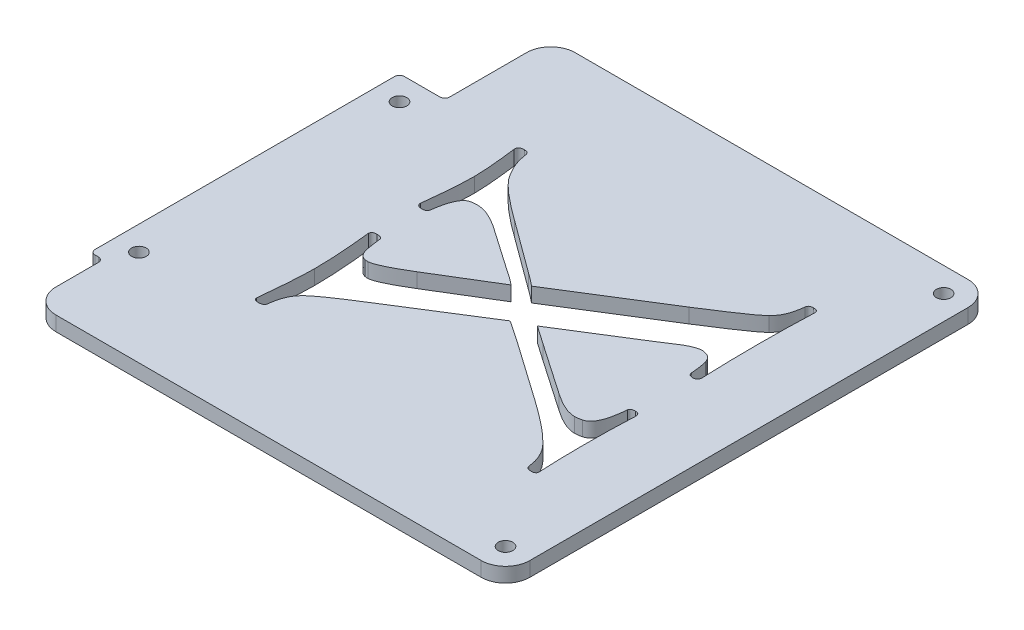
from build123d import *

# Parameters (mm, degrees)
BOSS_EXTRUDE1_DEPTH = 3
FILLET3_R           = 5
FILLET2_R           = 1
SKETCH2_R           = 1.5
CUT_EXTRUDE1_DEPTH  = 3
CUT_EXTRUDE2_DEPTH  = 3


with BuildPart() as part:
    # Sketch1 → Boss-Extrude1 (new body)
    with BuildSketch(Plane(origin=(0, 23, 0), x_dir=(1, 0, 0), z_dir=(0, 1, 0))):
        Polygon((98.305417602, 50), (98.305417602, 28.219474586), (89, 28.219474586), (89, -35.308001182), (91.659783805, -35.308001182), (91.659783805, -50), (97.650210801, -50), (189, -50), (189, 50), align=None)
    extrude(amount=BOSS_EXTRUDE1_DEPTH)

    # Fillet3
    fillet3_edges = [part.edges().sort_by_distance(p)[0] for p in [
        (189, 24.5, 50),
        (91.659783805, 24.5, 50),
        (98.305417602, 24.5, -50),
        (189, 24.5, -50),
    ]]
    fillet(fillet3_edges, radius=FILLET3_R)

    # Fillet2
    fillet2_edges = [part.edges().sort_by_distance(p)[0] for p in [
        (91.659783805, 24.5, 35.308001182),
        (89, 24.5, 35.308001182),
        (89, 24.5, -28.219474586),
        (98.305417602, 24.5, -28.219474586),
    ]]
    fillet(fillet2_edges, radius=FILLET2_R)

    # Sketch2 → Cut-Extrude1 (cut)
    with BuildSketch(Plane(origin=(0, 23, 0), x_dir=(1, 0, 0), z_dir=(0, 1, 0))):
        with Locations(Location((184, -45, 0), (0, 0, 90))):
            Circle(SKETCH2_R)
        with Locations(Location((94, -30.308001182, 0), (0, 0, 90))):
            Circle(SKETCH2_R)
        with Locations(Location((94, 23.219474586, 0), (0, 0, 90))):
            Circle(SKETCH2_R)
        with Locations(Location((184, 45, 0), (0, 0, 90))):
            Circle(SKETCH2_R)
    extrude(amount=CUT_EXTRUDE1_DEPTH, mode=Mode.SUBTRACT)

    # Sketch4 → Cut-Extrude2 (cut)
    with BuildSketch(Plane(origin=(0, 23, 0), x_dir=(1, 0, 0), z_dir=(0, 1, 0))):
        with BuildLine():
            Line((144.351606199, -4.405002967), (127.464586968, -15.042022198))
            add(Edge.make_bspline(
                [(127.464586968, -15.042022198), (126.898195291, -15.392246735), (125.816649312, -16.061013517), (124.298008902, -17.050886016), (122.928570135, -17.937550274), (121.736460133, -18.755591493), (120.693040345, -19.471486976), (119.829981473, -20.120669627), (119.12574917, -20.683215798), (118.725159512, -21.045947399), (118.546317738, -21.207887583)],
                knots=[0, 0, 0, 0, 1.472320828, 2.811451392, 4.007980441, 5.079214572, 6.008113963, 6.805362668, 7.466658574, 8, 8, 8, 8], degree=3))
            add(Edge.make_bspline(
                [(118.546317738, -21.207887583), (118.263268852, -21.52191014), (117.683869123, -22.164712831), (117.069628337, -23.367577881), (116.612007961, -24.745013365), (116.485430713, -25.743352665), (116.418913892, -26.267983736)],
                knots=[0, 0, 0, 0, 0.902760983, 1.847947461, 2.869088265, 4, 4, 4, 4], degree=3))
            add(Edge.make_bspline(
                [(116.418913892, -26.267983736), (116.387940503, -26.380485447), (116.328812035, -26.595252187), (116.080845919, -26.857180094), (115.710546665, -26.9748707), (115.437845471, -26.991879637), (115.289106199, -27.001156813)],
                knots=[0, 0, 0, 0, 0.934842855, 1.784623105, 2.791668119, 4, 4, 4, 4], degree=3))
            add(Edge.make_bspline(
                [(115.289106199, -27.001156813), (115.130908357, -26.999292557), (114.851041741, -26.995994514), (114.501215815, -26.864071662), (114.242986627, -26.653061509), (114.219472959, -26.454352171), (114.20737543, -26.352118352)],
                knots=[0, 0, 0, 0, 1.334053444, 2.360063937, 3.15627052, 4, 4, 4, 4], degree=3))
            add(Edge.make_bspline(
                [(114.20737543, -26.352118352), (114.268178243, -25.731192556), (114.385045957, -24.537725092), (114.542697081, -22.811043643), (114.674899579, -21.216431706), (114.783146686, -19.754038379), (114.868719382, -18.427912295), (114.929513254, -17.23393227), (114.96811794, -16.172085521), (114.97391698, -15.506792147), (114.976606199, -15.198272198)],
                knots=[0, 0, 0, 0, 1.338835045, 2.573344634, 3.720713761, 4.772456593, 5.720092408, 6.572327828, 7.337938175, 8, 8, 8, 8], degree=3))
            add(Edge.make_bspline(
                [(114.976606199, -15.198272198), (114.966353935, -14.352743878), (114.944718967, -12.568457125), (114.788786135, -9.755087799), (114.550052177, -6.665181967), (114.324888908, -4.516691888), (114.20737543, -3.395387583)],
                knots=[0, 0, 0, 0, 0.857425488, 1.8093929, 2.856714678, 4, 4, 4, 4], degree=3))
            add(Edge.make_bspline(
                [(114.20737543, -3.395387583), (114.219504891, -3.282548355), (114.242815012, -3.065696499), (114.485943912, -2.807073443), (114.858043405, -2.682888604), (115.139907847, -2.669736878), (115.30112543, -2.662214506)],
                knots=[0, 0, 0, 0, 0.896287379, 1.722464648, 2.697321511, 4, 4, 4, 4], degree=3))
            add(Edge.make_bspline(
                [(115.30112543, -2.662214506), (115.454724646, -2.666597614), (115.726836384, -2.674362596), (116.076824294, -2.781865744), (116.347574841, -2.95469515), (116.411314659, -3.136752797), (116.442952353, -3.227118352)],
                knots=[0, 0, 0, 0, 1.332929307, 2.361377367, 3.186658482, 4, 4, 4, 4], degree=3))
            add(Edge.make_bspline(
                [(116.442952353, -3.227118352), (116.497916769, -3.671982018), (116.597069328, -4.474489789), (116.745095088, -5.551059507), (116.903778138, -6.367065066), (117.037474033, -6.817488836), (117.091990815, -7.001156813)],
                knots=[0, 0, 0, 0, 1.402649067, 2.530296048, 3.400703139, 4, 4, 4, 4], degree=3))
            add(Edge.make_bspline(
                [(117.091990815, -7.001156813), (117.163574771, -7.178202401), (117.300694232, -7.517334195), (117.637220309, -7.934591169), (118.043428733, -8.253438433), (118.36170506, -8.363764981), (118.522279276, -8.419426044)],
                knots=[0, 0, 0, 0, 1.087727893, 2.083548742, 3.033127403, 4, 4, 4, 4], degree=3))
            add(Edge.make_bspline(
                [(118.522279276, -8.419426044), (118.630304172, -8.43344845), (118.845766867, -8.461417053), (119.062998086, -8.465478018), (119.171317738, -8.467502967)],
                knots=[0, 0, 0, 0, 1.002724816, 2, 2, 2, 2], degree=3))
            add(Edge.make_bspline(
                [(119.171317738, -8.467502967), (119.316448598, -8.45638107), (119.653109081, -8.430581573), (120.204532816, -8.250909029), (120.88139693, -8.002753917), (121.669593013, -7.626516985), (122.602749101, -7.193065113), (123.639286004, -6.616881611), (124.806837448, -5.958831664), (125.618620375, -5.476455961), (126.046317738, -5.222310659)],
                knots=[0, 0, 0, 0, 0.455388663, 1.056366421, 1.80829184, 2.719763092, 3.793795105, 5.036993135, 6.438905055, 8, 8, 8, 8], degree=3))
            Line((126.046317738, -5.222310659), (138.053529276, 2.085381648))
            add(Edge.make_bspline(
                [(138.053529276, 2.085381648), (137.625539491, 2.428371758), (136.709075245, 3.162824268), (135.727924095, 3.808529268), (135.204971584, 4.152689341)],
                knots=[0, 0, 0, 0, 0.934002144, 2, 2, 2, 2], degree=3))
            Line((135.204971584, 4.152689341), (125.721798507, 10.727208571))
            add(Edge.make_bspline(
                [(125.721798507, 10.727208571), (125.210941024, 11.050460946), (124.260516269, 11.651855797), (122.85079505, 12.333795342), (121.580650763, 12.770656194), (120.768488483, 12.836525319), (120.397279276, 12.866631648)],
                knots=[0, 0, 0, 0, 1.247971206, 2.321787911, 3.232951599, 4, 4, 4, 4], degree=3))
            add(Edge.make_bspline(
                [(120.397279276, 12.866631648), (120.168294528, 12.860419876), (119.687368419, 12.847373578), (119.214638474, 12.75747602), (118.966990815, 12.710381648)],
                knots=[0, 0, 0, 0, 0.952265823, 2, 2, 2, 2], degree=3))
            add(Edge.make_bspline(
                [(118.966990815, 12.710381648), (118.814875446, 12.64937105), (118.495315611, 12.521201642), (118.068424889, 12.167626018), (117.697698582, 11.674411308), (117.376577481, 11.043719136), (117.079856792, 10.286993292), (116.815115154, 9.391108691), (116.605859048, 8.35647488), (116.499220799, 7.618833988), (116.442952353, 7.229612417)],
                knots=[0, 0, 0, 0, 0.620651059, 1.303846888, 2.075212062, 2.954796131, 3.987916046, 5.164650224, 6.50390711, 8, 8, 8, 8], degree=3))
            add(Edge.make_bspline(
                [(116.442952353, 7.229612417), (116.416940226, 7.112745653), (116.367130285, 6.888960539), (116.125303524, 6.629167127), (115.784814478, 6.478578705), (115.527305163, 6.466850862), (115.385260045, 6.460381648)],
                knots=[0, 0, 0, 0, 0.978881351, 1.874434332, 2.82751339, 4, 4, 4, 4], degree=3))
            add(Edge.make_bspline(
                [(115.385260045, 6.460381648), (115.210395971, 6.463299781), (114.901482009, 6.468454939), (114.508332777, 6.645053538), (114.236087746, 6.934658897), (114.217206325, 7.183949923), (114.20737543, 7.313747033)],
                knots=[0, 0, 0, 0, 1.261486588, 2.228535625, 3.07766052, 4, 4, 4, 4], degree=3))
            add(Edge.make_bspline(
                [(114.20737543, 7.313747033), (114.268416816, 7.854508859), (114.386829326, 8.903517889), (114.543843905, 10.433970874), (114.675208596, 11.86842069), (114.784687163, 13.206542418), (114.869564266, 14.444607976), (114.929969489, 15.586548033), (114.968683047, 16.632388141), (114.974051853, 17.297692402), (114.976606199, 17.614227802)],
                knots=[0, 0, 0, 0, 1.263852355, 2.451712507, 3.572946922, 4.609147954, 5.569733427, 6.454894785, 7.264876952, 8, 8, 8, 8], degree=3))
            add(Edge.make_bspline(
                [(114.976606199, 17.614227802), (114.974003298, 17.874678434), (114.968475016, 18.427847421), (114.929540125, 19.305427434), (114.869074048, 20.279095234), (114.784140053, 21.34888522), (114.674500217, 22.518702864), (114.543441584, 23.784925284), (114.385299658, 25.150965033), (114.268196519, 26.091880692), (114.20737543, 26.580573956)],
                knots=[0, 0, 0, 0, 0.69420381, 1.474413845, 2.34104263, 3.294390515, 4.334682741, 5.472713655, 6.687376705, 8, 8, 8, 8], degree=3))
            add(Edge.make_bspline(
                [(114.20737543, 26.580573956), (114.217577606, 26.721020585), (114.237058609, 26.989202725), (114.493672996, 27.322573749), (114.904183999, 27.494156335), (115.211256703, 27.509423045), (115.385260045, 27.518073956)],
                knots=[0, 0, 0, 0, 0.970347507, 1.852873742, 2.783326749, 4, 4, 4, 4], degree=3))
            add(Edge.make_bspline(
                [(115.385260045, 27.518073956), (115.526951308, 27.507387883), (115.790530005, 27.487509301), (116.153040554, 27.316869106), (116.368105009, 26.978814056), (116.409007813, 26.719548958), (116.430933122, 26.580573956)],
                knots=[0, 0, 0, 0, 1.080128821, 2.009290766, 2.932911441, 4, 4, 4, 4], degree=3))
            add(Edge.make_bspline(
                [(116.430933122, 26.580573956), (116.516348907, 26.08799141), (116.691362911, 25.078706715), (117.249960375, 23.58987962), (118.002945616, 22.073780289), (118.669367281, 21.115918163), (119.015067738, 20.619035494)],
                knots=[0, 0, 0, 0, 0.912299322, 1.869269932, 2.894702262, 4, 4, 4, 4], degree=3))
            add(Edge.make_bspline(
                [(119.015067738, 20.619035494), (119.192546105, 20.408141742), (119.572599716, 19.956532155), (120.248788208, 19.284099273), (121.034141778, 18.541873374), (121.959064876, 17.748043668), (123.001703526, 16.882553452), (124.17634726, 15.961198449), (125.481767215, 14.989096948), (126.390522782, 14.32048406), (126.86362543, 13.972400879)],
                knots=[0, 0, 0, 0, 0.641462297, 1.373632554, 2.218314875, 3.157246719, 4.210645128, 5.373201843, 6.632475872, 8, 8, 8, 8], degree=3))
            Line((126.86362543, 13.972400879), (137.656894661, 6.051727802))
            add(Edge.make_bspline(
                [(137.656894661, 6.051727802), (138.088794504, 5.743444252), (139.012780403, 5.083917146), (139.892637272, 4.366496146), (140.361221584, 3.98442011)],
                knots=[0, 0, 0, 0, 0.934862412, 2, 2, 2, 2], degree=3))
            Line((140.361221584, 3.98442011), (160.289106199, 16.436343187))
            add(Edge.make_bspline(
                [(160.289106199, 16.436343187), (160.938640397, 16.852246648), (162.171218805, 17.641479346), (163.912766037, 18.773176707), (165.455139669, 19.775082238), (166.770331705, 20.678996589), (167.881094102, 21.445268828), (168.777850636, 22.094547837), (169.461362995, 22.630622941), (169.841251607, 22.957744074), (170.000644661, 23.094997033)],
                knots=[0, 0, 0, 0, 1.570948896, 2.981086596, 4.230448196, 5.316880004, 6.231423087, 6.978976257, 7.571600499, 8, 8, 8, 8], degree=3))
            add(Edge.make_bspline(
                [(170.000644661, 23.094997033), (170.291905749, 23.429099085), (170.884472926, 24.108825688), (171.518260826, 25.364560381), (171.967816943, 26.798429222), (172.096693244, 27.831209773), (172.164106199, 28.371439341)],
                knots=[0, 0, 0, 0, 0.911944529, 1.855340164, 2.87816569, 4, 4, 4, 4], degree=3))
            add(Edge.make_bspline(
                [(172.164106199, 28.371439341), (172.186816503, 28.479616779), (172.230811323, 28.689180106), (172.462492429, 28.94454591), (172.81099076, 29.067591071), (173.068745295, 29.083751037), (173.209779276, 29.092593187)],
                knots=[0, 0, 0, 0, 0.92937462, 1.800401638, 2.79645914, 4, 4, 4, 4], degree=3))
            add(Edge.make_bspline(
                [(173.209779276, 29.092593187), (173.35513711, 29.084747589), (173.613787319, 29.070787107), (173.95728722, 28.943800376), (174.181921037, 28.68939339), (174.198712094, 28.479654173), (174.20737543, 28.371439341)],
                knots=[0, 0, 0, 0, 1.251514999, 2.226949926, 3.085195799, 4, 4, 4, 4], degree=3))
            add(Edge.make_bspline(
                [(174.20737543, 28.371439341), (174.137266764, 26.488640924), (173.998870138, 22.771939943), (173.977523646, 19.052732497), (173.966990815, 17.217593187)],
                knots=[0, 0, 0, 0, 1.013155713, 2, 2, 2, 2], degree=3))
            add(Edge.make_bspline(
                [(173.966990815, 17.217593187), (173.967948158, 16.147853356), (173.969823509, 14.052327372), (174.024125396, 10.975395797), (174.088485798, 8.026167011), (174.168294019, 6.103713808), (174.20737543, 5.162304725)],
                knots=[0, 0, 0, 0, 1.064517092, 2.0852951, 3.062385195, 4, 4, 4, 4], degree=3))
            add(Edge.make_bspline(
                [(174.20737543, 5.162304725), (174.19937171, 5.023524385), (174.184776507, 4.770451143), (173.986765955, 4.435734937), (173.635842388, 4.26560836), (173.375614145, 4.246976381), (173.233817738, 4.236823956)],
                knots=[0, 0, 0, 0, 1.077694319, 1.965232209, 2.891270377, 4, 4, 4, 4], degree=3))
            add(Edge.make_bspline(
                [(173.233817738, 4.236823956), (173.096204774, 4.244489073), (172.848801261, 4.258269583), (172.518044642, 4.392407183), (172.290732245, 4.63976824), (172.246852998, 4.849640758), (172.224202353, 4.957977802)],
                knots=[0, 0, 0, 0, 1.198628502, 2.154919811, 3.047562131, 4, 4, 4, 4], degree=3))
            add(Edge.make_bspline(
                [(172.224202353, 4.957977802), (172.186630509, 5.366931637), (172.118001871, 6.113925713), (171.991293747, 7.121354648), (171.848706279, 7.908193033), (171.706897879, 8.344330089), (171.647279276, 8.527689341)],
                knots=[0, 0, 0, 0, 1.359375823, 2.483032554, 3.362241729, 4, 4, 4, 4], degree=3))
            add(Edge.make_bspline(
                [(171.647279276, 8.527689341), (171.569645335, 8.695739423), (171.421208452, 9.017052885), (171.100169091, 9.425821246), (170.711248321, 9.740534172), (170.405408114, 9.853583429), (170.253048507, 9.909900879)],
                knots=[0, 0, 0, 0, 1.090324143, 2.084710812, 3.045865452, 4, 4, 4, 4], degree=3))
            add(Edge.make_bspline(
                [(170.253048507, 9.909900879), (170.0982278, 9.962015773), (169.793959753, 10.064436807), (169.473130308, 10.073646557), (169.315548507, 10.07817011)],
                knots=[0, 0, 0, 0, 1.017659983, 2, 2, 2, 2], degree=3))
            add(Edge.make_bspline(
                [(169.315548507, 10.07817011), (169.105845291, 10.061561831), (168.641348147, 10.024774135), (167.913711186, 9.78543657), (167.08190412, 9.434566033), (166.519674811, 9.111598262), (166.214586968, 8.936343187)],
                knots=[0, 0, 0, 0, 0.754303268, 1.670797996, 2.736082945, 4, 4, 4, 4], degree=3))
            add(Edge.make_bspline(
                [(166.214586968, 8.936343187), (166.157981288, 8.90512432), (166.012773704, 8.825040196), (165.769094105, 8.650851989), (165.425106061, 8.435902647), (164.989758554, 8.159512534), (164.468336614, 7.807514874), (163.84035761, 7.417701763), (163.132625189, 6.958764641), (162.632776509, 6.632778424), (162.368433122, 6.460381648)],
                knots=[0, 0, 0, 0, 0.338924079, 0.869424174, 1.569081894, 2.467021618, 3.574674522, 4.869189774, 6.344280959, 8, 8, 8, 8], degree=3))
            Line((162.368433122, 6.460381648), (148.053529276, -2.505964506))
            add(Edge.make_bspline(
                [(148.053529276, -2.505964506), (148.302620465, -2.66919637), (148.852885509, -3.029790373), (149.730638318, -3.64033589), (150.747430067, -4.354657877), (151.467217402, -4.86541557), (151.851606199, -5.138176044)],
                knots=[0, 0, 0, 0, 0.773275811, 1.708236445, 2.77612707, 4, 4, 4, 4], degree=3))
            Line((151.851606199, -5.138176044), (162.368433122, -12.361733736))
            add(Edge.make_bspline(
                [(162.368433122, -12.361733736), (162.655843278, -12.551690793), (163.205816925, -12.915183082), (164.016291182, -13.41357692), (164.77900913, -13.838873723), (165.505221063, -14.165173433), (166.163534846, -14.4638541), (166.794987985, -14.630385225), (167.370484935, -14.76950977), (167.744300731, -14.783156208), (167.921317738, -14.789618352)],
                knots=[0, 0, 0, 0, 1.347273761, 2.578075442, 3.721064646, 4.758547125, 5.692670437, 6.54068866, 7.308956635, 8, 8, 8, 8], degree=3))
            add(Edge.make_bspline(
                [(167.921317738, -14.789618352), (168.154543405, -14.780111116), (168.661559171, -14.759443072), (169.156468824, -14.646357819), (169.423721584, -14.585291429)],
                knots=[0, 0, 0, 0, 0.91999375, 2, 2, 2, 2], degree=3))
            add(Edge.make_bspline(
                [(169.423721584, -14.585291429), (169.613482558, -14.51952393), (170.001545732, -14.38502871), (170.506337338, -13.96726778), (170.959962679, -13.403757767), (171.312783132, -12.655407087), (171.646667432, -11.766061833), (171.898913233, -10.703560346), (172.102250763, -9.478669158), (172.182067776, -8.604466368), (172.224202353, -8.142983736)],
                knots=[0, 0, 0, 0, 0.645506943, 1.32006844, 2.08573434, 2.973204213, 3.98269544, 5.159176813, 6.500358757, 8, 8, 8, 8], degree=3))
            add(Edge.make_bspline(
                [(172.224202353, -8.142983736), (172.246794572, -8.052619898), (172.292312084, -7.870560003), (172.554038322, -7.697597172), (172.891667069, -7.589987506), (173.156199486, -7.582383817), (173.305933122, -7.57807989)],
                knots=[0, 0, 0, 0, 0.810849161, 1.633652517, 2.660573178, 4, 4, 4, 4], degree=3))
            add(Edge.make_bspline(
                [(173.305933122, -7.57807989), (173.44066038, -7.586804218), (173.684075708, -7.602566695), (174.003659681, -7.787347656), (174.18208814, -8.114690478), (174.19837161, -8.36509912), (174.20737543, -8.503560659)],
                knots=[0, 0, 0, 0, 1.090267451, 1.969815268, 2.877424912, 4, 4, 4, 4], degree=3))
            add(Edge.make_bspline(
                [(174.20737543, -8.503560659), (174.168257463, -9.300720126), (174.087884553, -10.938587084), (174.023488797, -13.475262448), (173.969799079, -16.155573718), (173.967941694, -17.994714193), (173.966990815, -18.936252967)],
                knots=[0, 0, 0, 0, 0.917642433, 1.885414754, 2.917448651, 4, 4, 4, 4], degree=3))
            add(Edge.make_bspline(
                [(173.966990815, -18.936252967), (173.976339114, -20.531079435), (173.994736513, -23.669688694), (174.137268464, -26.805100564), (174.20737543, -28.347310659)],
                knots=[0, 0, 0, 0, 1.016263152, 2, 2, 2, 2], degree=3))
            add(Edge.make_bspline(
                [(174.20737543, -28.347310659), (174.199701118, -28.449218952), (174.18494348, -28.645187741), (173.942157943, -28.856444346), (173.613002928, -28.992407913), (173.348182606, -28.994921411), (173.197760045, -28.996349121)],
                knots=[0, 0, 0, 0, 0.87169135, 1.676255137, 2.680072402, 4, 4, 4, 4], degree=3))
            add(Edge.make_bspline(
                [(173.197760045, -28.996349121), (173.05583823, -28.99339545), (172.796128418, -28.987990381), (172.465347514, -28.856473725), (172.215641472, -28.645170348), (172.173831348, -28.449219631), (172.152086968, -28.347310659)],
                knots=[0, 0, 0, 0, 1.244289692, 2.276987812, 3.103905296, 4, 4, 4, 4], degree=3))
            add(Edge.make_bspline(
                [(172.152086968, -28.347310659), (172.065557832, -27.822045463), (171.896832079, -26.797815138), (171.348008496, -25.353206673), (170.593260953, -24.031922411), (169.918933195, -23.280375947), (169.579971584, -22.902599121)],
                knots=[0, 0, 0, 0, 1.039972447, 2.027873397, 3.008679084, 4, 4, 4, 4], degree=3))
            add(Edge.make_bspline(
                [(169.579971584, -22.902599121), (169.357039145, -22.676784401), (168.883181364, -22.196800141), (168.097285757, -21.463394298), (167.198178747, -20.670530128), (166.170760354, -19.831398828), (165.033635073, -18.932711021), (163.777516569, -17.981578444), (162.407448647, -16.97152959), (161.447913701, -16.286696208), (160.950163892, -15.931445275)],
                knots=[0, 0, 0, 0, 0.68550637, 1.457089547, 2.321849357, 3.274973221, 4.322649913, 5.453121873, 6.678830712, 8, 8, 8, 8], degree=3))
            Line((160.950163892, -15.931445275), (148.522279276, -7.205483736))
            add(Edge.make_bspline(
                [(148.522279276, -7.205483736), (148.226304076, -7.000424417), (147.600588239, -6.566912205), (146.603528429, -5.898916067), (145.513796458, -5.163691781), (144.748930948, -4.664380328), (144.351606199, -4.405002967)],
                knots=[0, 0, 0, 0, 0.86005721, 1.818231448, 2.866636514, 4, 4, 4, 4], degree=3))
        make_face()
    extrude(amount=CUT_EXTRUDE2_DEPTH, mode=Mode.SUBTRACT)


solid = part.part
